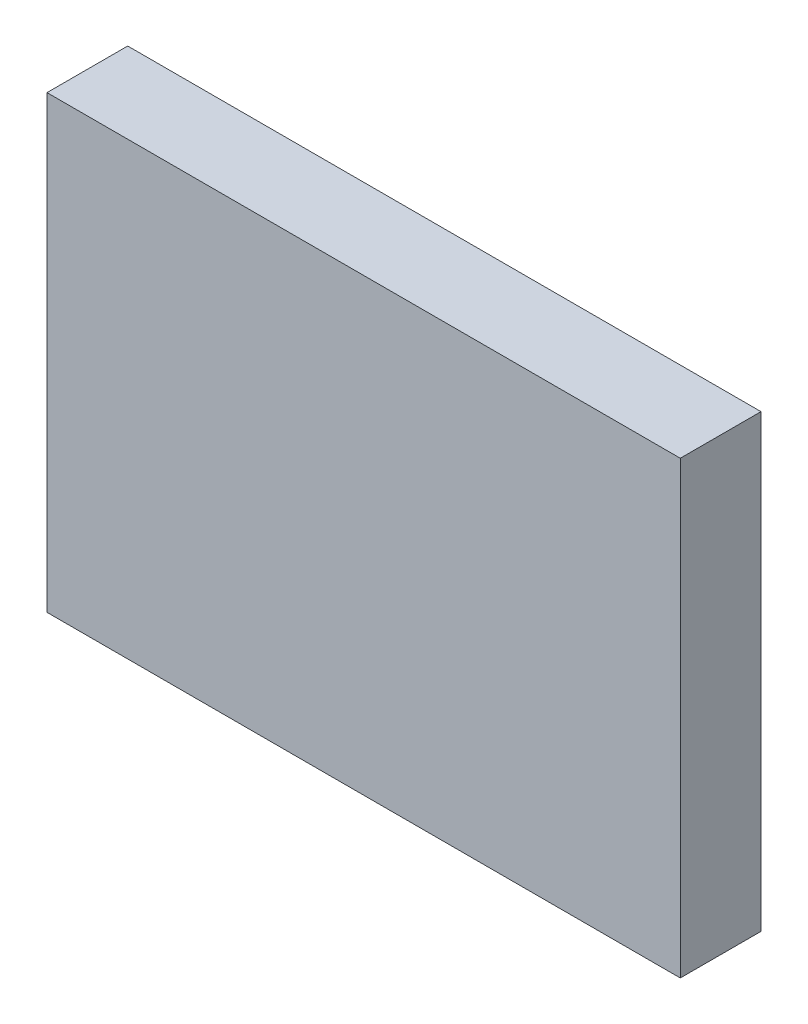
from build123d import *

# Parameters (mm, degrees)
ESBO_O1_W                = 20.4
ESBO_O1_H                = 14.5
RESSALTO_EXTRUS_O1_DEPTH = 2.6


with BuildPart() as part:
    # Esboço1 → Ressalto-extrusão1 (new body)
    with BuildSketch(Plane.XY):
        with Locations((-10.2, 7.25)):
            Rectangle(ESBO_O1_W, ESBO_O1_H)
    extrude(amount=RESSALTO_EXTRUS_O1_DEPTH)


solid = part.part
